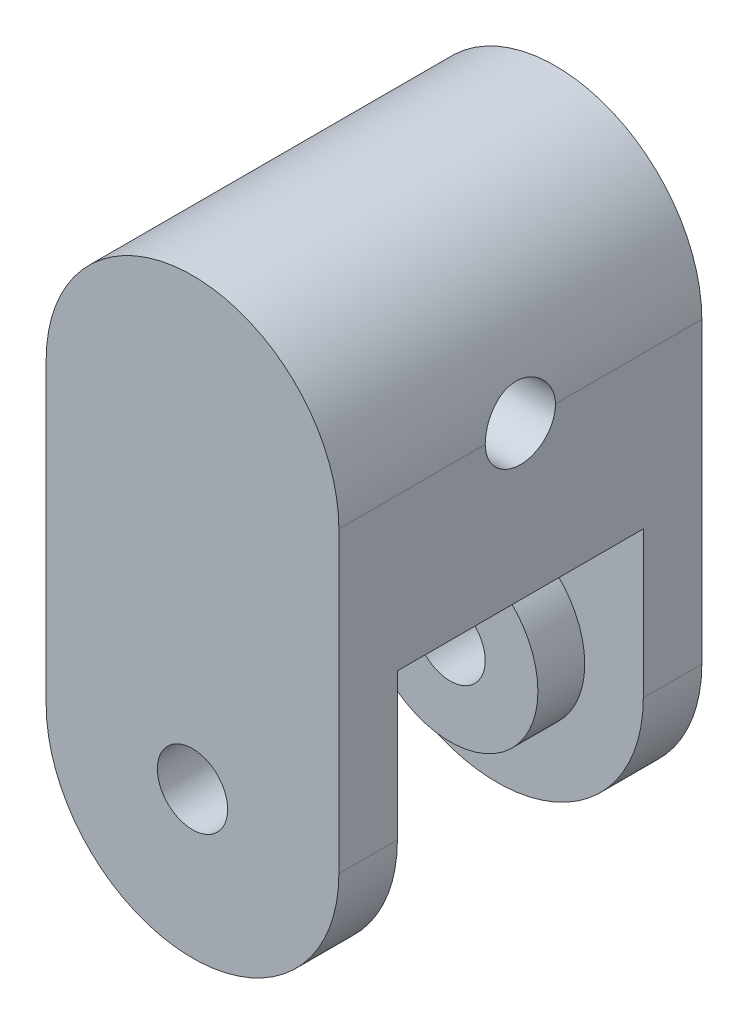
from build123d import *

# Parameters (mm, degrees)
BOSS_EXTRUDE2_DEPTH     = 15.5
CUT_EXTRUDE1_DEPTH      = 24.510635891
CUT_EXTRUDE1_DEPTH_BACK = 24.510635891
SKETCH5_W               = 25
SKETCH5_H               = 21
SKETCH6_R               = 7.5
BOSS_EXTRUDE3_DEPTH     = 4
SKETCH7_R               = 7.5
BOSS_EXTRUDE4_DEPTH     = 4
CUT_EXTRUDE2_DEPTH      = 36.68613176
CUT_EXTRUDE2_DEPTH_BACK = 36.68613176
SKETCH8_R               = 3
BOSS_EXTRUDE6_DEPTH     = 31
CUT_EXTRUDE3_DEPTH      = 49.054656382
CUT_EXTRUDE3_DEPTH_BACK = 49.054656382
SKETCH11_R              = 3


with BuildPart() as part:
    # Sketch1 → Boss-Extrude2 (new, symmetric)
    with BuildSketch(Plane.XY):
        with BuildLine():
            Line((-12.5, 0), (-12.5, 12.5))
            Line((-12.5, 12.5), (12.5, 12.5))
            Line((12.5, 12.5), (12.5, 0))
            ThreePointArc((12.5, 0), (0, -12.5), (-12.5, 0))
        make_face()
    extrude(amount=BOSS_EXTRUDE2_DEPTH, both=True)

    # Sketch5 → Cut-Extrude1 (cut, two sides: drawn at the far end of the back side and taken through both)
    with BuildSketch(Plane(origin=(0, 0, 0), x_dir=(1, 0, 0), z_dir=(0, 1, 0)).offset(-CUT_EXTRUDE1_DEPTH_BACK)):
        Rectangle(SKETCH5_W, SKETCH5_H)
    extrude(amount=CUT_EXTRUDE1_DEPTH + CUT_EXTRUDE1_DEPTH_BACK, mode=Mode.SUBTRACT)


with BuildPart() as cut_extrude1_piece_1:
    # of the separate pieces the step leaves, piece 1, a body of its own (cut_extrude1_pieces)
    add(part.part.solids().sort_by_distance((-12.5, 0, -15.5))[0])

    # Sketch6 → Boss-Extrude3 (add)
    with BuildSketch(Plane.XY.offset(-10.5)):
        Circle(SKETCH6_R)
    extrude(amount=BOSS_EXTRUDE3_DEPTH)


with BuildPart() as cut_extrude1_piece_2:
    # of the separate pieces the step leaves, piece 2, a body of its own (cut_extrude1_pieces)
    add(part.part.solids().sort_by_distance((-12.5, 0, 10.5))[0])

    # Sketch7 → Boss-Extrude4 (add)
    with BuildSketch(Plane(origin=(0, 0, 10.5), x_dir=(-1, 0, 0), z_dir=(0, 0, -1))):
        Circle(SKETCH7_R)
    extrude(amount=BOSS_EXTRUDE4_DEPTH)


with BuildPart() as cut_extrude2_tool:
    # Sketch8 → Cut-Extrude2 (new, two sides: drawn at the far end of the back side and taken through both)
    with BuildSketch(Plane(origin=(0, 0, -15.5), x_dir=(-1, 0, 0), z_dir=(0, 0, -1)).offset(-CUT_EXTRUDE2_DEPTH_BACK)):
        Circle(SKETCH8_R)
    extrude(amount=CUT_EXTRUDE2_DEPTH + CUT_EXTRUDE2_DEPTH_BACK)


with BuildPart() as cut_extrude1_piece_1_1:
    add(cut_extrude1_piece_1.part)

    # Cut-Extrude2: cut by cut_extrude2_tool
    add(cut_extrude2_tool.part, mode=Mode.SUBTRACT)


with BuildPart() as cut_extrude1_piece_2_1:
    add(cut_extrude1_piece_2.part)

    # Cut-Extrude2: cut by cut_extrude2_tool
    add(cut_extrude2_tool.part, mode=Mode.SUBTRACT)

    # Sketch9 → Boss-Extrude6 (add)
    with BuildSketch(Plane.XY.offset(15.5)):
        with BuildLine():
            Line((12.5, 12.5), (12.5, 25.5))
            ThreePointArc((12.5, 25.5), (0, 38), (-12.5, 25.5))
            Line((-12.5, 25.5), (-12.5, 12.5))
            Line((-12.5, 12.5), (12.5, 12.5))
        make_face()
    extrude(amount=-BOSS_EXTRUDE6_DEPTH)

    # Sketch11 → Cut-Extrude3 (cut, two sides: drawn at the far end of the back side and taken through both)
    with BuildSketch(Plane(origin=(12.5, 0, 0), x_dir=(0, 0, -1), z_dir=(1, 0, 0)).offset(-CUT_EXTRUDE3_DEPTH_BACK)):
        with Locations((0, 25.5)):
            Circle(SKETCH11_R)
    extrude(amount=CUT_EXTRUDE3_DEPTH + CUT_EXTRUDE3_DEPTH_BACK, mode=Mode.SUBTRACT)


with BuildPart() as cut_extrude1_piece_1_2:
    add(cut_extrude1_piece_1_1.part)

    # Combine1: union Cut-Extrude1 piece 2
    add(cut_extrude1_piece_2_1.part)


solid = cut_extrude1_piece_1_2.part
